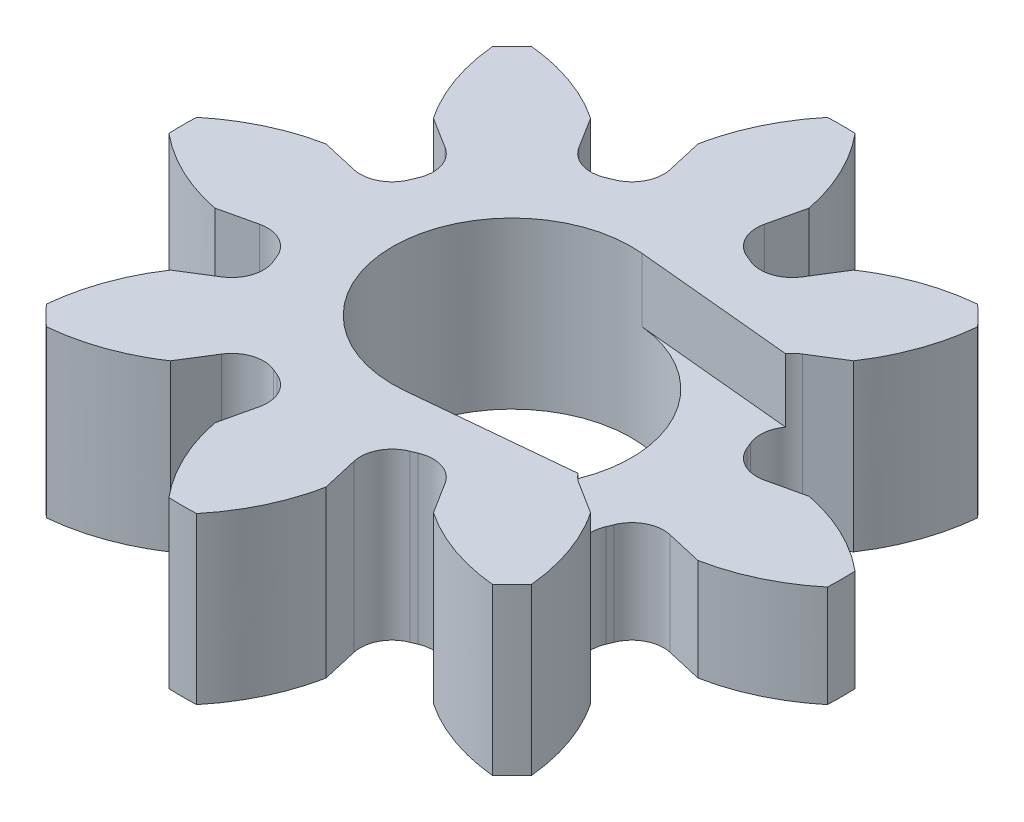
from build123d import *

# Parameters (mm, degrees)
SKETCH1_R           = 5.6945
SKETCH1_R_2         = 3.75
BOSS_EXTRUDE1_DEPTH = 5.2
BOSS_EXTRUDE3_START = -5.2
BOSS_EXTRUDE3_DEPTH = 5.2
FILLET1_R           = 1
FILLET2_R           = 1
CUT_EXTRUDE1_START  = -2
CUT_EXTRUDE1_DEPTH  = 2


with BuildPart() as part:
    # Sketch1 → Boss-Extrude1 (new body)
    with BuildSketch(Plane(origin=(0, 0, 0), x_dir=(1, 0, 0), z_dir=(0, 1, 0))):
        with Locations(Location((0, 0, 0), (0, 0, 270))):
            Circle(SKETCH1_R)
        with Locations(Location((0, 0, 0), (0, 0, 270))):
            Circle(SKETCH1_R_2, mode=Mode.SUBTRACT)
    extrude(amount=BOSS_EXTRUDE1_DEPTH)

    # Sketch2 → Boss-Extrude3 (add)
    with BuildSketch(Plane(origin=(0, 5.2, 0), x_dir=(1, 0, 0), z_dir=(0, 1, 0)).offset(BOSS_EXTRUDE3_START)):
        with BuildLine():
            Line((1.276851128, 5.549502811), (1.745257837, 7.585311288))
            add(Edge.make_bspline(
                [(1.745257837, 7.585311288), (1.554411596, 8.589760917), (1.089783036, 9.55790996), (0.435527939, 10.344585757)],
                knots=[0, 0, 0, 0, 1, 1, 1, 1], degree=3))
            ThreePointArc((0.435527939, 10.344585757), (0, 10.35375), (-0.435527939, 10.344585757))
            add(Edge.make_bspline(
                [(-1.745257837, 7.585311288), (-1.554411596, 8.589760917), (-1.089783036, 9.55790996), (-0.435527939, 10.344585757)],
                knots=[0, 0, 0, 0, 1, 1, 1, 1], degree=3))
            Line((-1.745257837, 7.585311288), (-1.276851128, 5.549502811))
            ThreePointArc((-1.276851128, 5.549502811), (0, 5.6945), (1.276851128, 5.549502811))
        make_face()
        with BuildLine():
            Line((3.021220978, 4.826961161), (4.129541397, 6.597708701))
            add(Edge.make_bspline(
                [(4.129541397, 6.597708701), (4.974743213, 7.173013173), (5.987869972, 7.529055922), (7.006761978, 7.622691496)],
                knots=[0, 0, 0, 0, 1, 1, 1, 1], degree=3))
            ThreePointArc((7.006761978, 7.622691496), (7.321206836, 7.321206836), (7.622691496, 7.006761978))
            add(Edge.make_bspline(
                [(6.597708701, 4.129541397), (7.173013173, 4.974743213), (7.529055922, 5.987869972), (7.622691496, 7.006761978)],
                knots=[0, 0, 0, 0, 1, 1, 1, 1], degree=3))
            Line((6.597708701, 4.129541397), (4.826961161, 3.021220978))
            ThreePointArc((4.826961161, 3.021220978), (4.026619565, 4.026619565), (3.021220978, 4.826961161))
        make_face()
        with BuildLine():
            Line((5.549502811, 1.276851128), (7.585311288, 1.745257837))
            add(Edge.make_bspline(
                [(7.585311288, 1.745257837), (8.589760917, 1.554411596), (9.55790996, 1.089783036), (10.344585757, 0.435527939)],
                knots=[0, 0, 0, 0, 1, 1, 1, 1], degree=3))
            ThreePointArc((10.344585757, 0.435527939), (10.35375, 0), (10.344585757, -0.435527939))
            add(Edge.make_bspline(
                [(7.585311288, -1.745257837), (8.589760917, -1.554411596), (9.55790996, -1.089783036), (10.344585757, -0.435527939)],
                knots=[0, 0, 0, 0, 1, 1, 1, 1], degree=3))
            Line((7.585311288, -1.745257837), (5.549502811, -1.276851128))
            ThreePointArc((5.549502811, -1.276851128), (5.6945, 0), (5.549502811, 1.276851128))
        make_face()
        with BuildLine():
            Line((4.826961161, -3.021220978), (6.597708701, -4.129541397))
            add(Edge.make_bspline(
                [(6.597708701, -4.129541397), (7.173013173, -4.974743213), (7.529055922, -5.987869972), (7.622691496, -7.006761978)],
                knots=[0, 0, 0, 0, 1, 1, 1, 1], degree=3))
            ThreePointArc((7.622691496, -7.006761978), (7.321206836, -7.321206836), (7.006761978, -7.622691496))
            add(Edge.make_bspline(
                [(4.129541397, -6.597708701), (4.974743213, -7.173013173), (5.987869972, -7.529055922), (7.006761978, -7.622691496)],
                knots=[0, 0, 0, 0, 1, 1, 1, 1], degree=3))
            Line((4.129541397, -6.597708701), (3.021220978, -4.826961161))
            ThreePointArc((3.021220978, -4.826961161), (4.026619565, -4.026619565), (4.826961161, -3.021220978))
        make_face()
        with BuildLine():
            Line((1.276851128, -5.549502811), (1.745257837, -7.585311288))
            add(Edge.make_bspline(
                [(1.745257837, -7.585311288), (1.554411596, -8.589760917), (1.089783036, -9.55790996), (0.435527939, -10.344585757)],
                knots=[0, 0, 0, 0, 1, 1, 1, 1], degree=3))
            ThreePointArc((0.435527939, -10.344585757), (0, -10.35375), (-0.435527939, -10.344585757))
            add(Edge.make_bspline(
                [(-1.745257837, -7.585311288), (-1.554411596, -8.589760917), (-1.089783036, -9.55790996), (-0.435527939, -10.344585757)],
                knots=[0, 0, 0, 0, 1, 1, 1, 1], degree=3))
            Line((-1.745257837, -7.585311288), (-1.276851128, -5.549502811))
            ThreePointArc((-1.276851128, -5.549502811), (0, -5.6945), (1.276851128, -5.549502811))
        make_face()
        with BuildLine():
            Line((-3.021220978, -4.826961161), (-4.129541397, -6.597708701))
            add(Edge.make_bspline(
                [(-4.129541397, -6.597708701), (-4.974743213, -7.173013173), (-5.987869972, -7.529055922), (-7.006761978, -7.622691496)],
                knots=[0, 0, 0, 0, 1, 1, 1, 1], degree=3))
            ThreePointArc((-7.006761978, -7.622691496), (-7.321206836, -7.321206836), (-7.622691496, -7.006761978))
            add(Edge.make_bspline(
                [(-6.597708701, -4.129541397), (-7.173013173, -4.974743213), (-7.529055922, -5.987869972), (-7.622691496, -7.006761978)],
                knots=[0, 0, 0, 0, 1, 1, 1, 1], degree=3))
            Line((-6.597708701, -4.129541397), (-4.826961161, -3.021220978))
            ThreePointArc((-4.826961161, -3.021220978), (-4.026619565, -4.026619565), (-3.021220978, -4.826961161))
        make_face()
        with BuildLine():
            Line((-5.549502811, -1.276851128), (-7.585311288, -1.745257837))
            add(Edge.make_bspline(
                [(-7.585311288, -1.745257837), (-8.589760917, -1.554411596), (-9.55790996, -1.089783036), (-10.344585757, -0.435527939)],
                knots=[0, 0, 0, 0, 1, 1, 1, 1], degree=3))
            ThreePointArc((-10.344585757, -0.435527939), (-10.35375, 0), (-10.344585757, 0.435527939))
            add(Edge.make_bspline(
                [(-7.585311288, 1.745257837), (-8.589760917, 1.554411596), (-9.55790996, 1.089783036), (-10.344585757, 0.435527939)],
                knots=[0, 0, 0, 0, 1, 1, 1, 1], degree=3))
            Line((-7.585311288, 1.745257837), (-5.549502811, 1.276851128))
            ThreePointArc((-5.549502811, 1.276851128), (-5.6945, 0), (-5.549502811, -1.276851128))
        make_face()
        with BuildLine():
            Line((-4.826961161, 3.021220978), (-6.597708701, 4.129541397))
            add(Edge.make_bspline(
                [(-6.597708701, 4.129541397), (-7.173013173, 4.974743213), (-7.529055922, 5.987869972), (-7.622691496, 7.006761978)],
                knots=[0, 0, 0, 0, 1, 1, 1, 1], degree=3))
            ThreePointArc((-7.622691496, 7.006761978), (-7.321206836, 7.321206836), (-7.006761978, 7.622691496))
            add(Edge.make_bspline(
                [(-4.129541397, 6.597708701), (-4.974743213, 7.173013173), (-5.987869972, 7.529055922), (-7.006761978, 7.622691496)],
                knots=[0, 0, 0, 0, 1, 1, 1, 1], degree=3))
            Line((-4.129541397, 6.597708701), (-3.021220978, 4.826961161))
            ThreePointArc((-3.021220978, 4.826961161), (-4.026619565, 4.026619565), (-4.826961161, 3.021220978))
        make_face()
    extrude(amount=BOSS_EXTRUDE3_DEPTH)

    # Fillet1
    fillet1_edges = [part.edges().sort_by_distance(p)[0] for p in [
        (1.276851128, 2.6, -5.549502811),
        (-1.276851128, 2.6, -5.549502811),
    ]]
    fillet(fillet1_edges, radius=FILLET1_R)

    # Fillet2
    fillet2_edges = [part.edges().sort_by_distance(p)[0] for p in [
        (-5.549502811, 2.6, -1.276851128),
        (-5.549502811, 2.6, 1.276851128),
        (-3.021220978, 2.6, -4.826961161),
        (-4.826961161, 2.6, -3.021220978),
        (4.826961161, 2.6, -3.021220978),
        (3.021220978, 2.6, -4.826961161),
        (5.549502811, 2.6, 1.276851128),
        (5.549502811, 2.6, -1.276851128),
        (3.021220978, 2.6, 4.826961161),
        (4.826961161, 2.6, 3.021220978),
        (-1.276851128, 2.6, 5.549502811),
        (1.276851128, 2.6, 5.549502811),
        (-4.826961161, 2.6, 3.021220978),
        (-3.021220978, 2.6, 4.826961161),
    ]]
    fillet(fillet2_edges, radius=FILLET2_R)

    # Sketch3 → Cut-Extrude1 (cut)
    with BuildSketch(Plane(origin=(0, 5.2, 0), x_dir=(1, 0, 0), z_dir=(0, 1, 0)).offset(CUT_EXTRUDE1_START)):
        with BuildLine():
            Line((0.356514085, 3.73301456), (14.428169014, 2.389129319))
            ThreePointArc((14.428169014, 2.389129319), (11.8, 0), (14.428169014, -2.389129319))
            Line((14.428169014, -2.389129319), (0.356514085, -3.73301456))
            ThreePointArc((0.356514085, -3.73301456), (3.75, 0), (0.356514085, 3.73301456))
        make_face()
    extrude(amount=CUT_EXTRUDE1_DEPTH, mode=Mode.SUBTRACT)


solid = part.part
